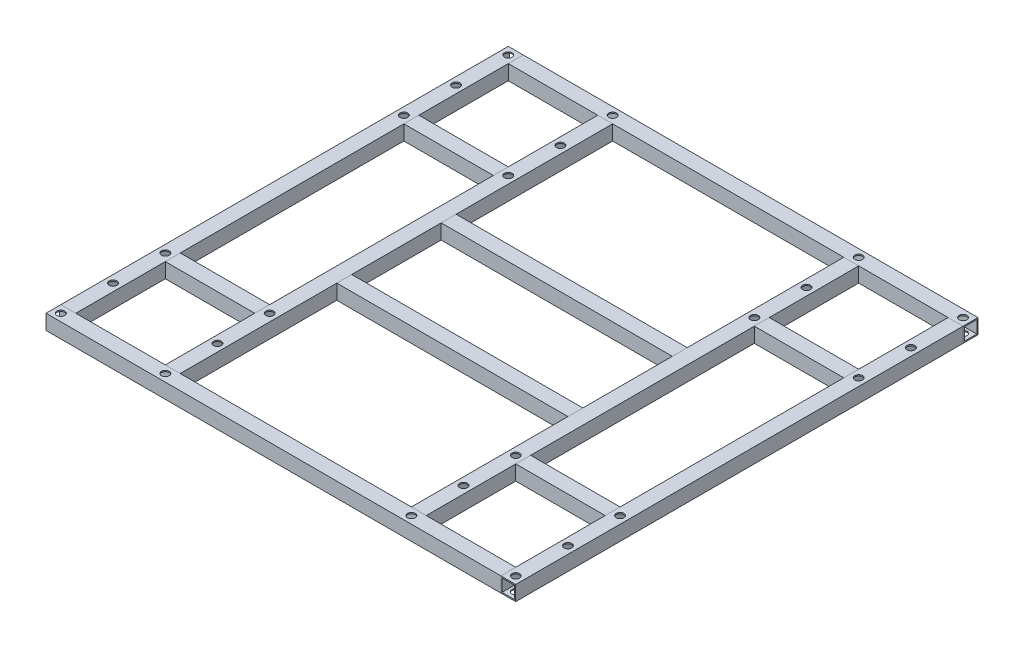
from build123d import *

# Parameters (mm, degrees)
INOX_VU_NG_CONFIGURED_10X0_8_1_DEPTH      = 310
INOX_VU_NG_CONFIGURED_10X0_8_1_DEPTH_BACK = 1
SKETCH11_W                                = 10
SKETCH11_H                                = 10
SKETCH11_W_2                              = 8.4
SKETCH11_H_2                              = 8.4
SKETCH11_ON_SEGMENT_2_W                   = 10
SKETCH11_ON_SEGMENT_2_H                   = 10
SKETCH11_ON_SEGMENT_2_W_2                 = 8.4
SKETCH11_ON_SEGMENT_2_H_2                 = 8.4
INOX_VU_NG_CONFIGURED_10X0_8_1_2_DEPTH    = 306
SKETCH11_ON_SEGMENT_3_W                   = 10
SKETCH11_ON_SEGMENT_3_H                   = 10
SKETCH11_ON_SEGMENT_3_W_2                 = 8.4
SKETCH11_ON_SEGMENT_3_H_2                 = 8.4
INOX_VU_NG_CONFIGURED_10X0_8_1_3_DEPTH    = 311
SKETCH11_ON_SEGMENT_4_W                   = 10
SKETCH11_ON_SEGMENT_4_H                   = 10
SKETCH11_ON_SEGMENT_4_W_2                 = 8.4
SKETCH11_ON_SEGMENT_4_H_2                 = 8.4
INOX_VU_NG_CONFIGURED_10X0_8_1_4_DEPTH    = 306
SKETCH11_ON_SEGMENT_5_W                   = 10
SKETCH11_ON_SEGMENT_5_H                   = 10
SKETCH11_ON_SEGMENT_5_W_2                 = 8.4
SKETCH11_ON_SEGMENT_5_H_2                 = 8.4
INOX_VU_NG_CONFIGURED_10X0_8_1_5_DEPTH    = 302
SKETCH11_ON_SEGMENT_6_W                   = 10
SKETCH11_ON_SEGMENT_6_H                   = 10
SKETCH11_ON_SEGMENT_6_W_2                 = 8.4
SKETCH11_ON_SEGMENT_6_H_2                 = 8.4
INOX_VU_NG_CONFIGURED_10X0_8_1_6_DEPTH    = 302
SKETCH11_ON_SEGMENT_7_W                   = 10
SKETCH11_ON_SEGMENT_7_H                   = 10
SKETCH11_ON_SEGMENT_7_W_2                 = 8.4
SKETCH11_ON_SEGMENT_7_H_2                 = 8.4
INOX_VU_NG_CONFIGURED_10X0_8_1_7_DEPTH    = 72
SKETCH11_ON_SEGMENT_8_W                   = 10
SKETCH11_ON_SEGMENT_8_H                   = 10
SKETCH11_ON_SEGMENT_8_W_2                 = 8.4
SKETCH11_ON_SEGMENT_8_H_2                 = 8.4
INOX_VU_NG_CONFIGURED_10X0_8_1_8_DEPTH    = 72
SKETCH11_ON_SEGMENT_9_W                   = 10
SKETCH11_ON_SEGMENT_9_H                   = 10
SKETCH11_ON_SEGMENT_9_W_2                 = 8.4
SKETCH11_ON_SEGMENT_9_H_2                 = 8.4
INOX_VU_NG_CONFIGURED_10X0_8_1_9_DEPTH    = 72
SKETCH11_ON_SEGMENT_10_W                  = 10
SKETCH11_ON_SEGMENT_10_H                  = 10
SKETCH11_ON_SEGMENT_10_W_2                = 8.4
SKETCH11_ON_SEGMENT_10_H_2                = 8.4
INOX_VU_NG_CONFIGURED_10X0_8_1_10_DEPTH   = 72
SKETCH11_ON_SEGMENT_11_W                  = 10
SKETCH11_ON_SEGMENT_11_H                  = 10
SKETCH11_ON_SEGMENT_11_W_2                = 8.4
SKETCH11_ON_SEGMENT_11_H_2                = 8.4
INOX_VU_NG_CONFIGURED_10X0_8_1_11_DEPTH   = 167
SKETCH11_ON_SEGMENT_12_W                  = 10
SKETCH11_ON_SEGMENT_12_H                  = 10
SKETCH11_ON_SEGMENT_12_W_2                = 8.4
SKETCH11_ON_SEGMENT_12_H_2                = 8.4
INOX_VU_NG_CONFIGURED_10X0_8_1_12_DEPTH   = 167
SKETCH12_R                                = 2.6
CUT_EXTRUDE1_DEPTH                        = 222.204091282


with BuildPart() as part:
    # Sketch11 → Inox vuông - configured 10X0.8(1) (new, two sides: drawn at the far end of the back side and taken through both)
    with BuildSketch(Plane(origin=(-152.5, 0, -150), x_dir=(0, 0, -1), z_dir=(1, 0, 0)).offset(-INOX_VU_NG_CONFIGURED_10X0_8_1_DEPTH_BACK)):
        Rectangle(SKETCH11_W, SKETCH11_H)
        Rectangle(SKETCH11_W_2, SKETCH11_H_2, mode=Mode.SUBTRACT)
    extrude(amount=INOX_VU_NG_CONFIGURED_10X0_8_1_DEPTH + INOX_VU_NG_CONFIGURED_10X0_8_1_DEPTH_BACK)

    # Inox vuông - configured 10X0.8(1) end but
    split(bisect_by=Plane(origin=(-147.5, 0, -150), x_dir=(0, 1, 0), z_dir=(1, 0, 0)), keep=Keep.TOP)


with BuildPart() as body_2:
    # Sketch11 on segment 2 (carried to segment 2) → Inox vu_ng - configured 10X0.8_1 2 (new body)
    with BuildSketch(Plane(origin=(152.5, 0, -151), x_dir=(1, 0, 0), z_dir=(0, 0, 1))):
        Rectangle(SKETCH11_ON_SEGMENT_2_W, SKETCH11_ON_SEGMENT_2_H)
        Rectangle(SKETCH11_ON_SEGMENT_2_W_2, SKETCH11_ON_SEGMENT_2_H_2, mode=Mode.SUBTRACT)
    extrude(amount=INOX_VU_NG_CONFIGURED_10X0_8_1_2_DEPTH)

    # Inox vu_ng - configured 10X0.8_1 2 end b
    split(bisect_by=Plane(origin=(152.5, 0, -145), x_dir=(0, -1, 0), z_dir=(0, 0, 1)), keep=Keep.TOP)


with BuildPart() as body_3:
    # Sketch11 on segment 3 (carried to segment 3) → Inox vu_ng - configured 10X0.8_1 3 (new body)
    with BuildSketch(Plane(origin=(153.5, 0, 150), x_dir=(0, 0, 1), z_dir=(-1, 0, 0))):
        Rectangle(SKETCH11_ON_SEGMENT_3_W, SKETCH11_ON_SEGMENT_3_H)
        Rectangle(SKETCH11_ON_SEGMENT_3_W_2, SKETCH11_ON_SEGMENT_3_H_2, mode=Mode.SUBTRACT)
    extrude(amount=INOX_VU_NG_CONFIGURED_10X0_8_1_3_DEPTH)

    # Inox vu_ng - configured 10X0.8_1 3 end b
    split(bisect_by=Plane(origin=(147.5, 0, 150), x_dir=(0, -1, 0), z_dir=(-1, 0, 0)), keep=Keep.TOP)


with BuildPart() as body_4:
    # Sketch11 on segment 4 (carried to segment 4) → Inox vu_ng - configured 10X0.8_1 4 (new body)
    with BuildSketch(Plane(origin=(-152.5, 0, 151), x_dir=(-1, 0, 0), z_dir=(0, 0, -1))):
        Rectangle(SKETCH11_ON_SEGMENT_4_W, SKETCH11_ON_SEGMENT_4_H)
        Rectangle(SKETCH11_ON_SEGMENT_4_W_2, SKETCH11_ON_SEGMENT_4_H_2, mode=Mode.SUBTRACT)
    extrude(amount=INOX_VU_NG_CONFIGURED_10X0_8_1_4_DEPTH)

    # Inox vu_ng - configured 10X0.8_1 4 end b
    split(bisect_by=Plane(origin=(-152.5, 0, 145), x_dir=(0, 1, 0), z_dir=(0, 0, -1)), keep=Keep.TOP)


with BuildPart() as body_5:
    # Sketch11 on segment 5 (carried to segment 5) → Inox vu_ng - configured 10X0.8_1 5 (new body)
    with BuildSketch(Plane(origin=(-82.5, 0, -151), x_dir=(1, 0, 0), z_dir=(0, 0, 1))):
        Rectangle(SKETCH11_ON_SEGMENT_5_W, SKETCH11_ON_SEGMENT_5_H)
        Rectangle(SKETCH11_ON_SEGMENT_5_W_2, SKETCH11_ON_SEGMENT_5_H_2, mode=Mode.SUBTRACT)
    extrude(amount=INOX_VU_NG_CONFIGURED_10X0_8_1_5_DEPTH)

    # Inox vu_ng - configured 10X0.8_1 5 end b
    split(bisect_by=Plane(origin=(-82.5, 0, -145), x_dir=(0, -1, 0), z_dir=(0, 0, 1)), keep=Keep.TOP)

    # Inox vu_ng - configured 10X0.8_1 5 e 2
    split(bisect_by=Plane(origin=(-82.5, 0, 145), x_dir=(0, 1, 0), z_dir=(0, 0, -1)), keep=Keep.TOP)


with BuildPart() as body_6:
    # Sketch11 on segment 6 (carried to segment 6) → Inox vu_ng - configured 10X0.8_1 6 (new body)
    with BuildSketch(Plane(origin=(82.5, 0, -151), x_dir=(1, 0, 0), z_dir=(0, 0, 1))):
        Rectangle(SKETCH11_ON_SEGMENT_6_W, SKETCH11_ON_SEGMENT_6_H)
        Rectangle(SKETCH11_ON_SEGMENT_6_W_2, SKETCH11_ON_SEGMENT_6_H_2, mode=Mode.SUBTRACT)
    extrude(amount=INOX_VU_NG_CONFIGURED_10X0_8_1_6_DEPTH)

    # Inox vu_ng - configured 10X0.8_1 6 end b
    split(bisect_by=Plane(origin=(82.5, 0, -145), x_dir=(0, -1, 0), z_dir=(0, 0, 1)), keep=Keep.TOP)

    # Inox vu_ng - configured 10X0.8_1 6 e 2
    split(bisect_by=Plane(origin=(82.5, 0, 145), x_dir=(0, 1, 0), z_dir=(0, 0, -1)), keep=Keep.TOP)


with BuildPart() as body_7:
    # Sketch11 on segment 7 (carried to segment 7) → Inox vu_ng - configured 10X0.8_1 7 (new body)
    with BuildSketch(Plane(origin=(-81.5, 0, -80), x_dir=(0, 0, 1), z_dir=(-1, 0, 0))):
        Rectangle(SKETCH11_ON_SEGMENT_7_W, SKETCH11_ON_SEGMENT_7_H)
        Rectangle(SKETCH11_ON_SEGMENT_7_W_2, SKETCH11_ON_SEGMENT_7_H_2, mode=Mode.SUBTRACT)
    extrude(amount=INOX_VU_NG_CONFIGURED_10X0_8_1_7_DEPTH)

    # Inox vu_ng - configured 10X0.8_1 7 end b
    split(bisect_by=Plane(origin=(-87.5, 0, -80), x_dir=(0, -1, 0), z_dir=(-1, 0, 0)), keep=Keep.TOP)

    # Inox vu_ng - configured 10X0.8_1 7 e 2
    split(bisect_by=Plane(origin=(-147.5, 0, -80), x_dir=(0, 1, 0), z_dir=(1, 0, 0)), keep=Keep.TOP)


with BuildPart() as body_8:
    # Sketch11 on segment 8 (carried to segment 8) → Inox vu_ng - configured 10X0.8_1 8 (new body)
    with BuildSketch(Plane(origin=(-153.5, 0, 80), x_dir=(0, 0, -1), z_dir=(1, 0, 0))):
        Rectangle(SKETCH11_ON_SEGMENT_8_W, SKETCH11_ON_SEGMENT_8_H)
        Rectangle(SKETCH11_ON_SEGMENT_8_W_2, SKETCH11_ON_SEGMENT_8_H_2, mode=Mode.SUBTRACT)
    extrude(amount=INOX_VU_NG_CONFIGURED_10X0_8_1_8_DEPTH)

    # Inox vu_ng - configured 10X0.8_1 8 end b
    split(bisect_by=Plane(origin=(-147.5, 0, 80), x_dir=(0, 1, 0), z_dir=(1, 0, 0)), keep=Keep.TOP)

    # Inox vu_ng - configured 10X0.8_1 8 e 2
    split(bisect_by=Plane(origin=(-87.5, 0, 80), x_dir=(0, -1, 0), z_dir=(-1, 0, 0)), keep=Keep.TOP)


with BuildPart() as body_9:
    # Sketch11 on segment 9 (carried to segment 9) → Inox vu_ng - configured 10X0.8_1 9 (new body)
    with BuildSketch(Plane(origin=(153.5, 0, 80), x_dir=(0, 0, 1), z_dir=(-1, 0, 0))):
        Rectangle(SKETCH11_ON_SEGMENT_9_W, SKETCH11_ON_SEGMENT_9_H)
        Rectangle(SKETCH11_ON_SEGMENT_9_W_2, SKETCH11_ON_SEGMENT_9_H_2, mode=Mode.SUBTRACT)
    extrude(amount=INOX_VU_NG_CONFIGURED_10X0_8_1_9_DEPTH)

    # Inox vu_ng - configured 10X0.8_1 9 end b
    split(bisect_by=Plane(origin=(147.5, 0, 80), x_dir=(0, -1, 0), z_dir=(-1, 0, 0)), keep=Keep.TOP)

    # Inox vu_ng - configured 10X0.8_1 9 e 2
    split(bisect_by=Plane(origin=(87.5, 0, 80), x_dir=(0, 1, 0), z_dir=(1, 0, 0)), keep=Keep.TOP)


with BuildPart() as body_10:
    # Sketch11 on segment 10 (carried to segment 10) → Inox vu_ng - configured 10X0.8_1 10 (new body)
    with BuildSketch(Plane(origin=(81.5, 0, -80), x_dir=(0, 0, -1), z_dir=(1, 0, 0))):
        Rectangle(SKETCH11_ON_SEGMENT_10_W, SKETCH11_ON_SEGMENT_10_H)
        Rectangle(SKETCH11_ON_SEGMENT_10_W_2, SKETCH11_ON_SEGMENT_10_H_2, mode=Mode.SUBTRACT)
    extrude(amount=INOX_VU_NG_CONFIGURED_10X0_8_1_10_DEPTH)

    # Inox vu_ng - configured 10X0.8_1 10 end
    split(bisect_by=Plane(origin=(87.5, 0, -80), x_dir=(0, 1, 0), z_dir=(1, 0, 0)), keep=Keep.TOP)

    # Inox vu_ng - configured 10X0.8_1 10  2
    split(bisect_by=Plane(origin=(147.5, 0, -80), x_dir=(0, -1, 0), z_dir=(-1, 0, 0)), keep=Keep.TOP)


with BuildPart() as body_11:
    # Sketch11 on segment 11 (carried to segment 11) → Inox vu_ng - configured 10X0.8_1 11 (new body)
    with BuildSketch(Plane(origin=(83.5, 0, -35), x_dir=(0, 0, 1), z_dir=(-1, 0, 0))):
        Rectangle(SKETCH11_ON_SEGMENT_11_W, SKETCH11_ON_SEGMENT_11_H)
        Rectangle(SKETCH11_ON_SEGMENT_11_W_2, SKETCH11_ON_SEGMENT_11_H_2, mode=Mode.SUBTRACT)
    extrude(amount=INOX_VU_NG_CONFIGURED_10X0_8_1_11_DEPTH)

    # Inox vu_ng - configured 10X0.8_1 11 end
    split(bisect_by=Plane(origin=(77.5, 0, -35), x_dir=(0, -1, 0), z_dir=(-1, 0, 0)), keep=Keep.TOP)

    # Inox vu_ng - configured 10X0.8_1 11  2
    split(bisect_by=Plane(origin=(-77.5, 0, -35), x_dir=(0, 1, 0), z_dir=(1, 0, 0)), keep=Keep.TOP)


with BuildPart() as body_12:
    # Sketch11 on segment 12 (carried to segment 12) → Inox vu_ng - configured 10X0.8_1 12 (new body)
    with BuildSketch(Plane(origin=(83.5, 0, 35), x_dir=(0, 0, 1), z_dir=(-1, 0, 0))):
        Rectangle(SKETCH11_ON_SEGMENT_12_W, SKETCH11_ON_SEGMENT_12_H)
        Rectangle(SKETCH11_ON_SEGMENT_12_W_2, SKETCH11_ON_SEGMENT_12_H_2, mode=Mode.SUBTRACT)
    extrude(amount=INOX_VU_NG_CONFIGURED_10X0_8_1_12_DEPTH)

    # Inox vu_ng - configured 10X0.8_1 12 end
    split(bisect_by=Plane(origin=(77.5, 0, 35), x_dir=(0, -1, 0), z_dir=(-1, 0, 0)), keep=Keep.TOP)

    # Inox vu_ng - configured 10X0.8_1 12  2
    split(bisect_by=Plane(origin=(-77.5, 0, 35), x_dir=(0, 1, 0), z_dir=(1, 0, 0)), keep=Keep.TOP)


with BuildPart() as cut_extrude1_tool:
    # Sketch12 → Cut-Extrude1 (new, through all)
    with BuildSketch(Plane(origin=(0, 5, 0), x_dir=(1, 0, 0), z_dir=(0, 1, 0))):
        with Locations(Location((-152.5, 150, 0), (0, 0, 270))):
            Circle(SKETCH12_R)
        with Locations(Location((-82.5, 150, 0), (0, 0, 270))):
            Circle(SKETCH12_R)
        with Locations(Location((-82.5, 80, 0), (0, 0, 270))):
            Circle(SKETCH12_R)
        with Locations(Location((-152.5, 80, 0), (0, 0, 270))):
            Circle(SKETCH12_R)
        with Locations(Location((-152.5, 115, 0), (0, 0, 270))):
            Circle(SKETCH12_R)
        with Locations(Location((-82.5, 115, 0), (0, 0, 270))):
            Circle(SKETCH12_R)
        with Locations(Location((82.5, 115, 0), (0, 0, 270))):
            Circle(SKETCH12_R)
        with Locations(Location((152.5, 115, 0), (0, 0, 90))):
            Circle(SKETCH12_R)
        with Locations(Location((152.5, 80, 0), (0, 0, 90))):
            Circle(SKETCH12_R)
        with Locations(Location((82.5, 80, 0), (0, 0, 270))):
            Circle(SKETCH12_R)
        with Locations(Location((82.5, 150, 0), (0, 0, 90))):
            Circle(SKETCH12_R)
        with Locations(Location((152.5, 150, 0), (0, 0, 90))):
            Circle(SKETCH12_R)
        with Locations(Location((152.5, -150, 0), (0, 0, 270))):
            Circle(SKETCH12_R)
        with Locations(Location((82.5, -150, 0), (0, 0, 270))):
            Circle(SKETCH12_R)
        with Locations(Location((82.5, -80, 0), (0, 0, 270))):
            Circle(SKETCH12_R)
        with Locations(Location((152.5, -80, 0), (0, 0, 270))):
            Circle(SKETCH12_R)
        with Locations(Location((152.5, -115, 0), (0, 0, 270))):
            Circle(SKETCH12_R)
        with Locations(Location((82.5, -115, 0), (0, 0, 270))):
            Circle(SKETCH12_R)
        with Locations(Location((-82.5, -115, 0), (0, 0, 270))):
            Circle(SKETCH12_R)
        with Locations(Location((-152.5, -115, 0), (0, 0, 90))):
            Circle(SKETCH12_R)
        with Locations(Location((-152.5, -80, 0), (0, 0, 90))):
            Circle(SKETCH12_R)
        with Locations(Location((-82.5, -80, 0), (0, 0, 270))):
            Circle(SKETCH12_R)
        with Locations(Location((-82.5, -150, 0), (0, 0, 90))):
            Circle(SKETCH12_R)
        with Locations(Location((-152.5, -150, 0), (0, 0, 90))):
            Circle(SKETCH12_R)
    extrude(amount=-CUT_EXTRUDE1_DEPTH)


with BuildPart() as part_1:
    add(part.part)

    # Cut-Extrude1: cut by cut_extrude1_tool
    add(cut_extrude1_tool.part, mode=Mode.SUBTRACT)


with BuildPart() as body_2_1:
    add(body_2.part)

    # Cut-Extrude1: cut by cut_extrude1_tool
    add(cut_extrude1_tool.part, mode=Mode.SUBTRACT)


with BuildPart() as body_3_1:
    add(body_3.part)

    # Cut-Extrude1: cut by cut_extrude1_tool
    add(cut_extrude1_tool.part, mode=Mode.SUBTRACT)


with BuildPart() as body_4_1:
    add(body_4.part)

    # Cut-Extrude1: cut by cut_extrude1_tool
    add(cut_extrude1_tool.part, mode=Mode.SUBTRACT)


with BuildPart() as body_5_1:
    add(body_5.part)

    # Cut-Extrude1: cut by cut_extrude1_tool
    add(cut_extrude1_tool.part, mode=Mode.SUBTRACT)


with BuildPart() as body_6_1:
    add(body_6.part)

    # Cut-Extrude1: cut by cut_extrude1_tool
    add(cut_extrude1_tool.part, mode=Mode.SUBTRACT)


solid = Compound([body_7.part, body_8.part, body_9.part, body_10.part, body_11.part, body_12.part, part_1.part, body_2_1.part, body_3_1.part, body_4_1.part, body_5_1.part, body_6_1.part])
